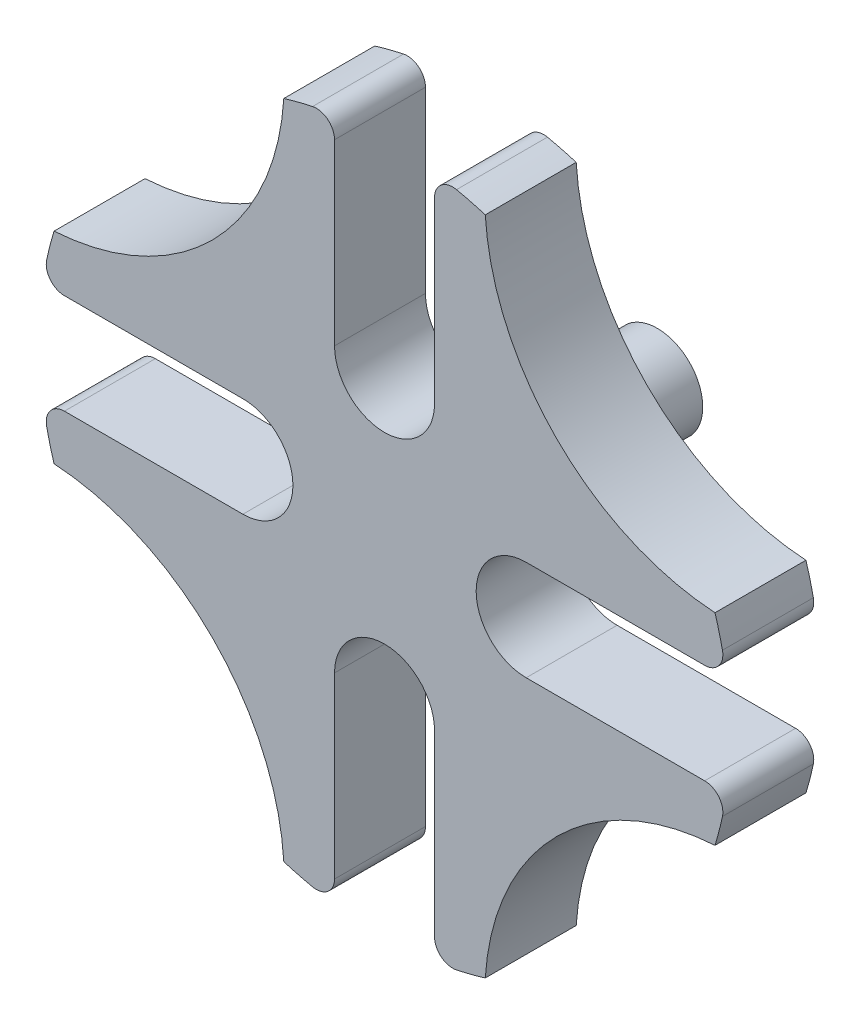
from build123d import *

# Parameters (mm, degrees)
SALIENTE_EXTRUIR1_DEPTH = 10
CROQUIS2_R              = 5
SALIENTE_EXTRUIR2_DEPTH = 20
REDONDEO1_R             = 2


with BuildPart() as part:
    # Croquis1 → Saliente-Extruir1 (new body)
    with BuildSketch(Plane.XY):
        with BuildLine():
            Line((-5.5, 37.599867021), (-5.5, 15.577785413))
            ThreePointArc((-5.5, 15.577785413), (0, 10.077785413), (5.5, 15.577785413))
            Line((5.5, 15.577785413), (5.5, 37.599867021))
            ThreePointArc((5.5, 37.599867021), (8.313819384, 37.079379812), (11.080493617, 36.348626676))
            ThreePointArc((11.080493617, 36.348626676), (18.9363196, 18.9363196), (36.348626676, 11.080493617))
            ThreePointArc((36.348626676, 11.080493617), (37.079379812, 8.313819384), (37.599867021, 5.5))
            Line((37.599867021, 5.5), (15.577785413, 5.5))
            ThreePointArc((15.577785413, 5.5), (10.077785413, 0), (15.577785413, -5.5))
            Line((15.577785413, -5.5), (37.599867021, -5.5))
            ThreePointArc((37.599867021, -5.5), (37.079379812, -8.313819384), (36.348626676, -11.080493617))
            ThreePointArc((36.348626676, -11.080493617), (18.9363196, -18.9363196), (11.080493617, -36.348626676))
            ThreePointArc((11.080493617, -36.348626676), (8.313819384, -37.079379812), (5.5, -37.599867021))
            Line((5.5, -37.599867021), (5.5, -15.577785413))
            ThreePointArc((5.5, -15.577785413), (0, -10.077785413), (-5.5, -15.577785413))
            Line((-5.5, -15.577785413), (-5.5, -37.599867021))
            ThreePointArc((-5.5, -37.599867021), (-8.313819384, -37.079379812), (-11.080493617, -36.348626676))
            ThreePointArc((-11.080493617, -36.348626676), (-18.9363196, -18.9363196), (-36.348626676, -11.080493617))
            ThreePointArc((-36.348626676, -11.080493617), (-37.079379812, -8.313819384), (-37.599867021, -5.5))
            Line((-37.599867021, -5.5), (-15.577785413, -5.5))
            ThreePointArc((-15.577785413, -5.5), (-10.077785413, 0), (-15.577785413, 5.5))
            Line((-15.577785413, 5.5), (-37.599867021, 5.5))
            ThreePointArc((-37.599867021, 5.5), (-37.079379812, 8.313819384), (-36.348626676, 11.080493617))
            ThreePointArc((-36.348626676, 11.080493617), (-18.9363196, 18.9363196), (-11.080493617, 36.348626676))
            ThreePointArc((-11.080493617, 36.348626676), (-8.313819384, 37.079379812), (-5.5, 37.599867021))
        make_face()
    extrude(amount=SALIENTE_EXTRUIR1_DEPTH)

    # Croquis2 → Saliente-Extruir2 (add)
    with BuildSketch(Plane(origin=(0, 0, 0), x_dir=(-1, 0, 0), z_dir=(0, 0, -1))):
        with Locations(Location((0, 0, 0), (0, 0, 180))):
            Circle(CROQUIS2_R)
    extrude(amount=SALIENTE_EXTRUIR2_DEPTH)

    # Redondeo1
    redondeo1_edges = [part.edges().sort_by_distance(p)[0] for p in [
        (-5.5, -37.599867021, 5),
        (-37.599867021, -5.5, 5),
        (-37.599867021, 5.5, 5),
        (-5.5, 37.599867021, 5),
        (5.5, 37.599867021, 5),
        (37.599867021, 5.5, 5),
        (37.599867021, -5.5, 5),
        (5.5, -37.599867021, 5),
    ]]
    fillet(redondeo1_edges, radius=REDONDEO1_R)


solid = part.part
